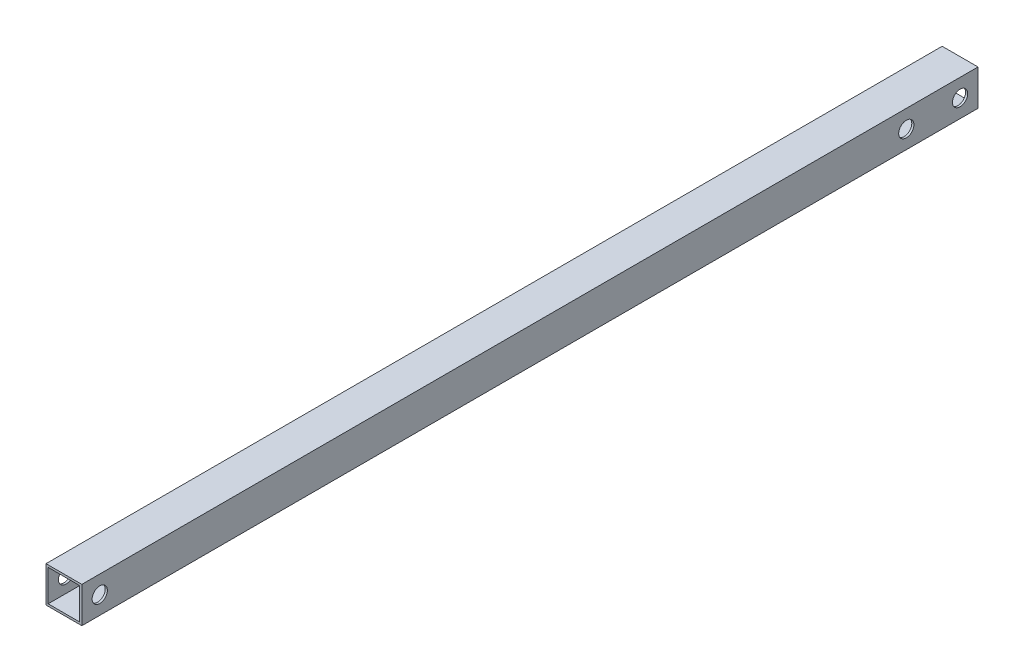
from build123d import *

# Parameters (mm, degrees)
SKETCH1_W           = 20
SKETCH1_H           = 20
SKETCH1_W_2         = 17.6
SKETCH1_H_2         = 17.6
BOSS_EXTRUDE1_DEPTH = 500
SKETCH2_R           = 4.25
CUT_EXTRUDE1_DEPTH  = 600


with BuildPart() as part:
    # Sketch1 → Boss-Extrude1 (new body)
    with BuildSketch(Plane.XY):
        Rectangle(SKETCH1_W, SKETCH1_H)
        Rectangle(SKETCH1_W_2, SKETCH1_H_2, mode=Mode.SUBTRACT)
    extrude(amount=BOSS_EXTRUDE1_DEPTH)

    # Sketch2 → Cut-Extrude1 (cut)
    with BuildSketch(Plane(origin=(10, 0, 0), x_dir=(0, 0, -1), z_dir=(1, 0, 0))):
        with Locations(Location((-490, 0, 0), (0, 0, 90))):
            Circle(SKETCH2_R)
        with Locations(Location((-10, 0, 0), (0, 0, 90))):
            Circle(SKETCH2_R)
        with Locations(Location((-40, 0, 0), (0, 0, 90))):
            Circle(SKETCH2_R)
    extrude(amount=-CUT_EXTRUDE1_DEPTH, mode=Mode.SUBTRACT)


solid = part.part
